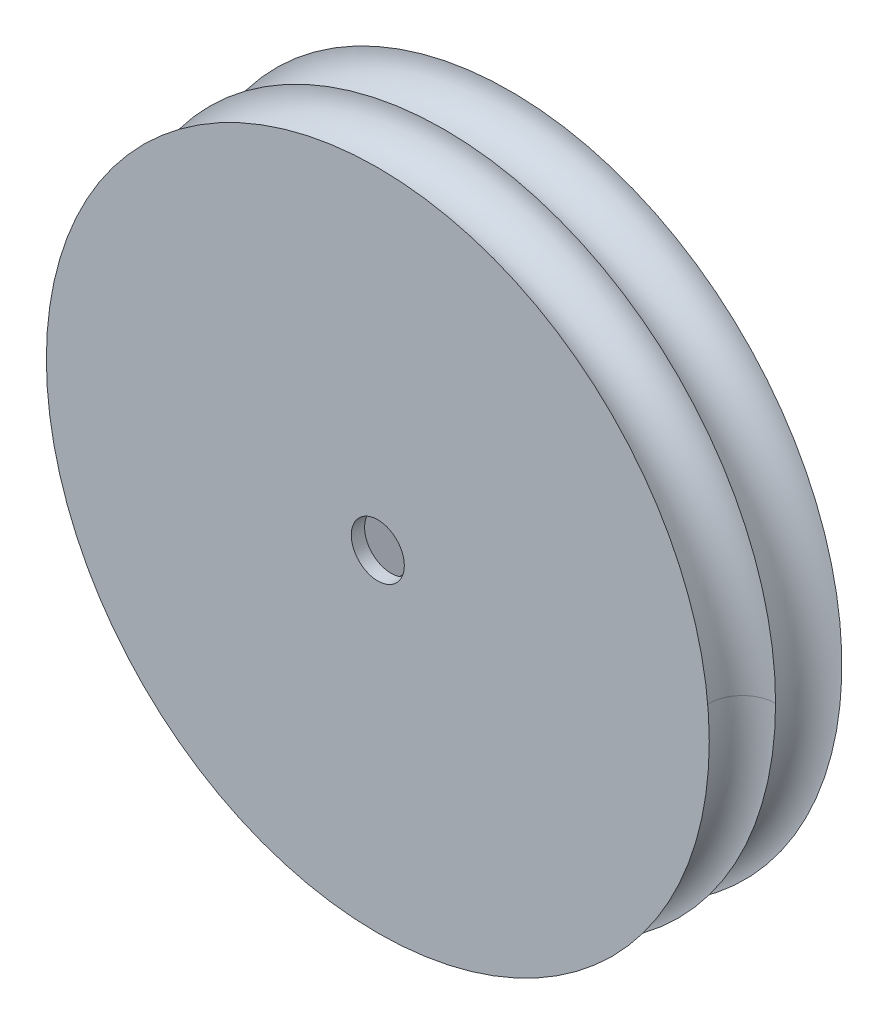
from build123d import *

# Parameters (mm, degrees)
EXTRUDE_START            = 1
SKETCH_1_R               = 25
EXTRUDE_1_DEPTH          = 4
SKETCH_4_R               = 25
SKETCH_4_R_2             = 2
EXTRUDE_3_DEPTH          = 1
SKETCH_6_R               = 2.5
SKETCH_8_R               = 25
SKETCH_8_R_2             = 19
EXTRUDE_4_DEPTH          = 5
SKETCH_11_R              = 9
EXTRUDE_6_DEPTH          = 2
REVOLVE_1_ANGLE          = 15
PATTERN_CIRCULAR_1_COUNT = 5
SKETCH_13_R              = 2.5


with BuildPart() as part:
    # 草图1 → 凸台-拉伸1 (new body)
    with BuildSketch(Plane.XY.offset(EXTRUDE_START)):
        Circle(SKETCH_1_R)
        Polygon((3.464101615, 6), (-3.464101615, 6), (-6.92820323, 0), (-3.464101615, -6), (3.464101615, -6), (6.92820323, 0), align=None, mode=Mode.SUBTRACT)
    extrude(amount=EXTRUDE_1_DEPTH)

    # 草图4 → 凸台-拉伸3 (add)
    with BuildSketch(Plane.XY.offset(5)):
        Circle(SKETCH_4_R)
        Circle(SKETCH_4_R_2, mode=Mode.SUBTRACT)
    extrude(amount=EXTRUDE_3_DEPTH)

    # 切除-扫描1: sweep along a curve in space
    with BuildLine() as sweep_1_path:
        ThreePointArc((25, 0, 1), (17.67766953, 17.67766953, 1), (0, 25, 1))
        ThreePointArc((0, 25, 1), (-17.67766953, 17.67766953, 1), (-25, 0, 1))
        ThreePointArc((-25, 0, 1), (-17.67766953, -17.67766953, 1), (0, -25, 1))
        ThreePointArc((0, -25, 1), (17.67766953, -17.67766953, 1), (25, 0, 1))
    # 草图6 → 切除-扫描1 (sweep, cut)
    with BuildSketch(Plane(origin=(0, 0, 0), x_dir=(1, 0, 0), z_dir=(0, 1, 0))):
        with Locations((-25, -3.5)):
            Circle(SKETCH_6_R)
    sweep(path=sweep_1_path.line, mode=Mode.SUBTRACT)

    # 草图8 → 凸台-拉伸4 (add)
    with BuildSketch(Plane(origin=(0, 0, 1), x_dir=(-1, 0, 0), z_dir=(0, 0, -1))):
        Circle(SKETCH_8_R)
        Circle(SKETCH_8_R_2, mode=Mode.SUBTRACT)
    extrude(amount=EXTRUDE_4_DEPTH)

    # 草图11 → 凸台-拉伸6 (add)
    with BuildSketch(Plane(origin=(0, 0, 1), x_dir=(-1, 0, 0), z_dir=(0, 0, -1))):
        with Locations(Location((0, 0, 0), (0, 0, 180))):
            Circle(SKETCH_11_R)
        Polygon((-3.464101615, 6), (-6.92820323, 0), (-3.464101615, -6), (3.464101615, -6), (6.92820323, 0), (3.464101615, 6), align=None, mode=Mode.SUBTRACT)
    extrude(amount=EXTRUDE_6_DEPTH)

    # 草图12 → 旋转1 (revolve)
    with BuildSketch(Plane(origin=(0, 0, 0), x_dir=(1, 0, 0), z_dir=(0, 1, 0))):
        with BuildLine():
            Line((19, 4), (19, -1))
            Line((19, -1), (9, -1))
            Line((9, -1), (9, 1))
            Line((9, 1), (9.392071205, 1))
            ThreePointArc((9.392071205, 1), (12.772046971, 1.385768449), (15.978171002, 2.52323149))
            Line((15.978171002, 2.52323149), (19, 4))
        make_face()
    revolve_1 = revolve(axis=Axis((0, 0, -23.418623899), (0, 0, 1)), revolution_arc=REVOLVE_1_ANGLE)

    # 阵列(圆周)1: 旋转1 ×5 about axis
    pattern_circular_1_axis = Axis((0, 0, 0), (0, 0, 1))
    for i in range(1, PATTERN_CIRCULAR_1_COUNT):
        add(revolve_1.rotate(pattern_circular_1_axis, i * 360 / PATTERN_CIRCULAR_1_COUNT))

    # 切除-扫描2: sweep along a curve in space
    with BuildLine() as sweep_2_path:
        ThreePointArc((-25, 0, -4), (-17.67766953, 17.67766953, -4), (0, 25, -4))
        ThreePointArc((0, 25, -4), (17.67766953, 17.67766953, -4), (25, 0, -4))
        ThreePointArc((25, 0, -4), (17.67766953, -17.67766953, -4), (0, -25, -4))
        ThreePointArc((0, -25, -4), (-17.67766953, -17.67766953, -4), (-25, 0, -4))
    # 草图13 → 切除-扫描2 (sweep, cut)
    with BuildSketch(Plane(origin=(0, 0, 0), x_dir=(1, 0, 0), z_dir=(0, 1, 0))):
        with Locations((-25, 1.5)):
            Circle(SKETCH_13_R)
    sweep(path=sweep_2_path.line, mode=Mode.SUBTRACT)


solid = part.part
